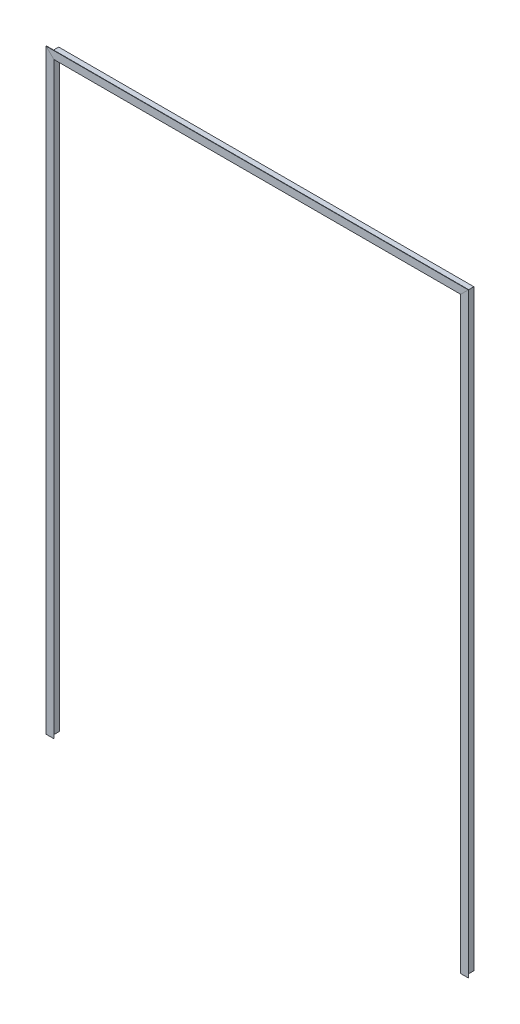
from build123d import *

# Parameters (mm, degrees)
ST_SECTION_ST6X17_5_1_DEPTH   = 10166.483526335
ST_SECTION_ST6X17_5_1_2_DEPTH = 7332.967052671
ST_SECTION_ST6X17_5_1_3_DEPTH = 10166.483526336


with BuildPart() as part:
    # Sketch11 → St section ST6X17.5(1) (new body)
    with BuildSketch(Plane(origin=(0, 0, 0), x_dir=(-1, 0, 0), z_dir=(0, 1, 0))):
        with BuildLine():
            Line((-64.4906, 152.4), (64.4906, 152.4))
            Line((64.4906, 152.4), (64.4906, 147.996286207))
            ThreePointArc((64.4906, 147.996286207), (63.226568979, 144.548546584), (60.033566439, 142.734871391))
            Line((60.033566439, 142.734871391), (14.986386201, 135.22646032))
            ThreePointArc((14.986386201, 135.22646032), (8.144237901, 131.340013477), (5.4356, 123.952))
            Line((5.4356, 123.952), (5.4356, 0))
            Line((5.4356, 0), (-5.4356, 0))
            Line((-5.4356, 0), (-5.4356, 123.952))
            ThreePointArc((-5.4356, 123.952), (-8.144237901, 131.340013477), (-14.986386201, 135.22646032))
            Line((-14.986386201, 135.22646032), (-60.033566439, 142.734871391))
            ThreePointArc((-60.033566439, 142.734871391), (-63.226568979, 144.548546584), (-64.4906, 147.996286207))
            Line((-64.4906, 147.996286207), (-64.4906, 152.4))
        make_face()
    extrude(amount=ST_SECTION_ST6X17_5_1_DEPTH)

    # St section ST6X17.5(1) mitre 1
    split(bisect_by=Plane(origin=(0, 10000, 0), x_dir=(0.707106781, -0.707106781, 0), z_dir=(-0.707106781, -0.707106781, 0)), keep=Keep.TOP)


with BuildPart() as body_2:
    # Sketch11 on segment 2 (carried to segment 2) → St section ST6X17.5_1 2 (new body)
    with BuildSketch(Plane(origin=(-166.483526335, 10000, 0), x_dir=(0, 1, 0), z_dir=(1, 0, 0))):
        with BuildLine():
            Line((-64.4906, 152.4), (64.4906, 152.4))
            Line((64.4906, 152.4), (64.4906, 147.996286207))
            ThreePointArc((64.4906, 147.996286207), (63.226568979, 144.548546584), (60.033566439, 142.734871391))
            Line((60.033566439, 142.734871391), (14.986386201, 135.22646032))
            ThreePointArc((14.986386201, 135.22646032), (8.144237901, 131.340013477), (5.4356, 123.952))
            Line((5.4356, 123.952), (5.4356, 0))
            Line((5.4356, 0), (-5.4356, 0))
            Line((-5.4356, 0), (-5.4356, 123.952))
            ThreePointArc((-5.4356, 123.952), (-8.144237901, 131.340013477), (-14.986386201, 135.22646032))
            Line((-14.986386201, 135.22646032), (-60.033566439, 142.734871391))
            ThreePointArc((-60.033566439, 142.734871391), (-63.226568979, 144.548546584), (-64.4906, 147.996286207))
            Line((-64.4906, 147.996286207), (-64.4906, 152.4))
        make_face()
    extrude(amount=ST_SECTION_ST6X17_5_1_2_DEPTH)

    # St section ST6X17.5_1 2 mitre 1
    split(bisect_by=Plane(origin=(0, 10000, 0), x_dir=(-0.707106781, 0.707106781, 0), z_dir=(0.707106781, 0.707106781, 0)), keep=Keep.TOP)

    # St section ST6X17.5_1 2 mitre 2
    split(bisect_by=Plane(origin=(7000, 10000, 0), x_dir=(-0.707106781, -0.707106781, 0), z_dir=(-0.707106781, 0.707106781, 0)), keep=Keep.TOP)


with BuildPart() as body_3:
    # Sketch11 on segment 3 (carried to segment 3) → St section ST6X17.5_1 3 (new body)
    with BuildSketch(Plane(origin=(7000, 10166.483526335, 0), x_dir=(1, 0, 0), z_dir=(0, -1, 0))):
        with BuildLine():
            Line((-64.4906, 152.4), (64.4906, 152.4))
            Line((64.4906, 152.4), (64.4906, 147.996286207))
            ThreePointArc((64.4906, 147.996286207), (63.226568979, 144.548546584), (60.033566439, 142.734871391))
            Line((60.033566439, 142.734871391), (14.986386201, 135.22646032))
            ThreePointArc((14.986386201, 135.22646032), (8.144237901, 131.340013477), (5.4356, 123.952))
            Line((5.4356, 123.952), (5.4356, 0))
            Line((5.4356, 0), (-5.4356, 0))
            Line((-5.4356, 0), (-5.4356, 123.952))
            ThreePointArc((-5.4356, 123.952), (-8.144237901, 131.340013477), (-14.986386201, 135.22646032))
            Line((-14.986386201, 135.22646032), (-60.033566439, 142.734871391))
            ThreePointArc((-60.033566439, 142.734871391), (-63.226568979, 144.548546584), (-64.4906, 147.996286207))
            Line((-64.4906, 147.996286207), (-64.4906, 152.4))
        make_face()
    extrude(amount=ST_SECTION_ST6X17_5_1_3_DEPTH)

    # St section ST6X17.5_1 3 mitre 1
    split(bisect_by=Plane(origin=(7000, 10000, 0), x_dir=(0.707106781, 0.707106781, 0), z_dir=(0.707106781, -0.707106781, 0)), keep=Keep.TOP)


solid = Compound([part.part, body_2.part, body_3.part])
